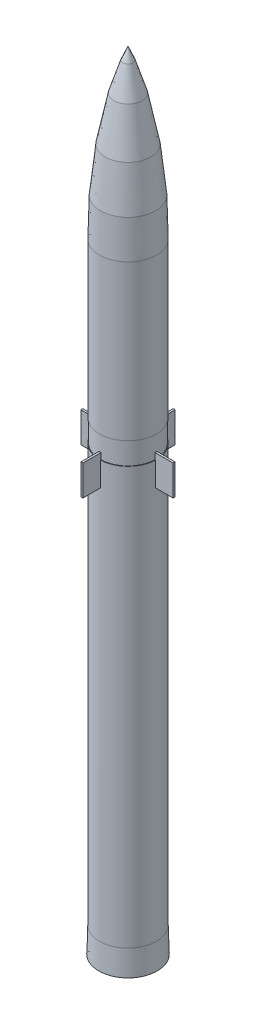
from build123d import *

# Parameters (mm, degrees)
SKETCH4_W           = 3500
SKETCH4_H           = 4800
BOSS_EXTRUDE1_DEPTH = 160
CIRPATTERN1_COUNT   = 4
BOSS_EXTRUDE4_DEPTH = 110


with BuildPart() as part:
    # Sketch1 → Revolve1 (revolve)
    with BuildSketch(Plane.XY, mode=Mode.PRIVATE) as revolve1_sk:
        Polygon((0, 124400), (800, 122500), (2200, 118000), (3600, 111000), (4350, 104000), (4500, 98000), (4500, 73500), (4420, 73500), (4420, 70000), (4500, 70000), (4500, 4000), (4620, 0), (4300, 0), (4300, 1500), (0, 4000), align=None)
    revolve(revolve1_sk.sketch.rotate(Axis((0, 0, 0), (0, 1, 0)), 90), axis=Axis((0, 0, 0), (0, 1, 0)))

    # Sketch4 → Boss-Extrude1 (add, symmetric)
    with BuildSketch(Plane.XY):
        with Locations((5550, 68600)):
            Rectangle(SKETCH4_W, SKETCH4_H)
    boss_extrude1 = extrude(amount=BOSS_EXTRUDE1_DEPTH, both=True)

    # CirPattern1: Boss-Extrude1 ×4 about axis
    cirpattern1_axis = Axis((0, 0, 0), (0, 1, 0))
    for i in range(1, CIRPATTERN1_COUNT):
        add(boss_extrude1.rotate(cirpattern1_axis, i * 360 / CIRPATTERN1_COUNT))

    # Sketch6 → Boss-Extrude4 (add, symmetric)
    with BuildSketch(Plane(origin=(0, 0, 0), x_dir=(0, 0, -1), z_dir=(1, 0, 0))):
        Polygon((4497.154656002, 70000), (4497.154656002, 0), (4400, 2000), align=None)
        Polygon((4497.154656002, 105000), (4500, 75000), (4400, 75000), align=None)
    extrude(amount=BOSS_EXTRUDE4_DEPTH, both=True)


solid = part.part
